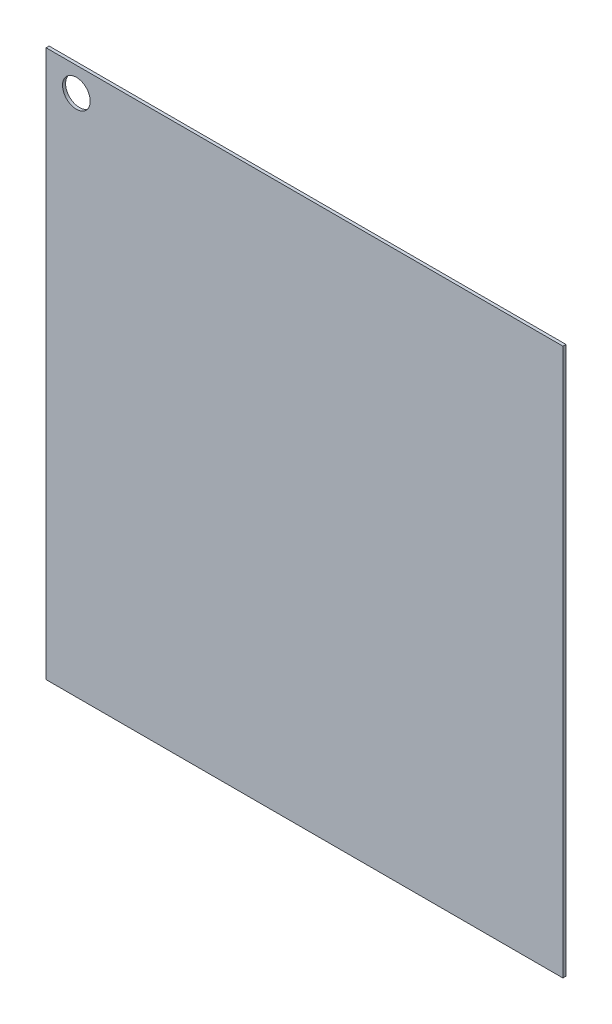
from build123d import *

# Parameters (mm, degrees)
SKETCH1_W           = 510
SKETCH1_H           = 540
BOSS_EXTRUDE1_DEPTH = 3
CUT_EXTRUDE1_REACH  = 373.395
SKETCH2_R           = 13.658333274


with BuildPart() as part:
    # Sketch1 → Boss-Extrude1 (new body)
    with BuildSketch(Plane.XY):
        Rectangle(SKETCH1_W, SKETCH1_H)
    extrude(amount=BOSS_EXTRUDE1_DEPTH)

    # Sketch2 → Cut-Extrude1 (cut, up to next)
    with BuildSketch(Plane.XY.offset(3), mode=Mode.PRIVATE) as cut_extrude1_sk1:
        with Locations((-225.092859776, 246.042633007)):
            Circle(SKETCH2_R)
    cut_extrude1_tool1 = extrude(cut_extrude1_sk1.sketch, amount=-CUT_EXTRUDE1_REACH, mode=Mode.PRIVATE) & part.part
    add(cut_extrude1_tool1.solids().sort_by_distance((-225.09286, 246.042633, 3))[0], mode=Mode.SUBTRACT)


solid = part.part
